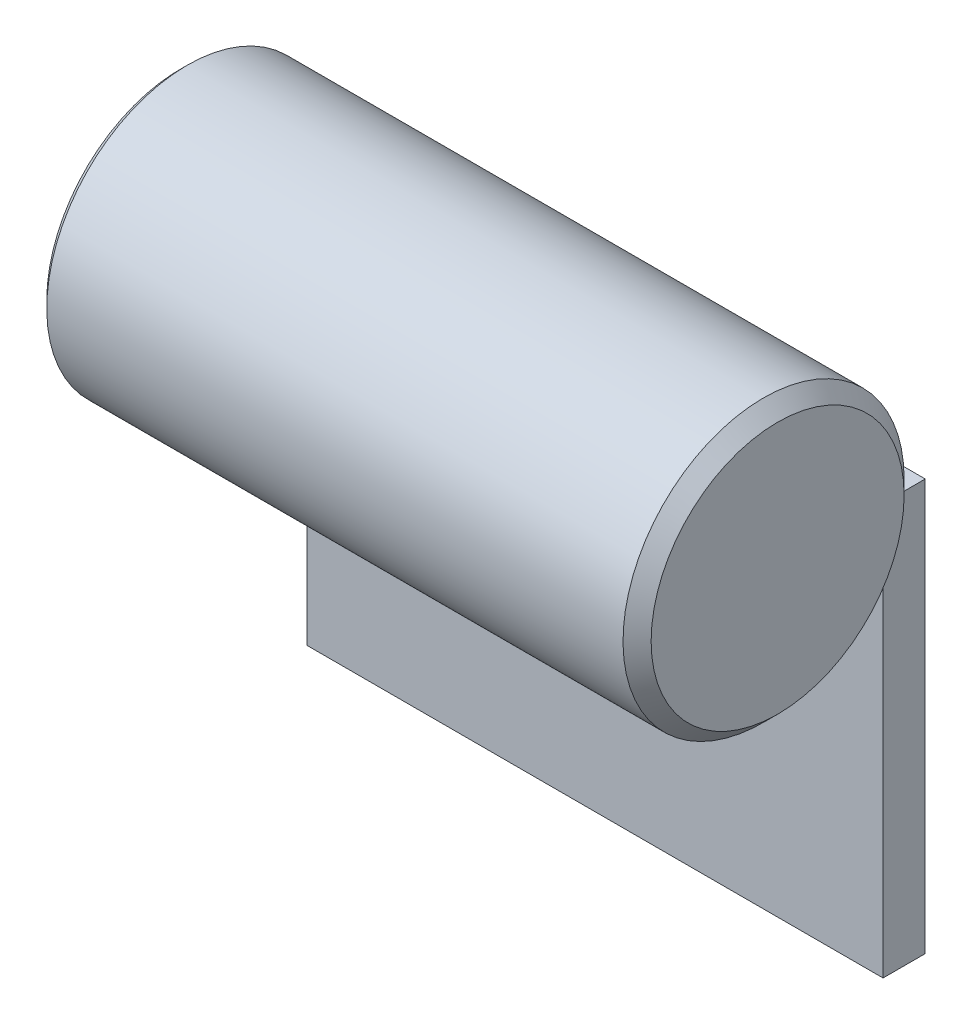
from build123d import *

# Parameters (mm, degrees)
SKETCH_2_W          = 82
SKETCH_2_H          = 6.001237201
EXTRUDE_1_DEPTH     = 60
SKETCH_3_W          = 82
SKETCH_3_H          = 3.004928021
CUT_EXTRUDE_1_DEPTH = 1.5


with BuildPart() as part:
    # Эскиз1 → Повернуть4 (revolve)
    with BuildSketch(Plane(origin=(0, 0, 0), x_dir=(1, 0, 0), z_dir=(0, 1, 0))):
        Polygon((92.65287472, 0), (92.65287472, 18), (90.65287472, 20), (8.65287472, 20), (7.65287472, 19), (7.65287472, 14.750046626), (8.65287472, 13.750046626), (71.629429714, 13.750046626), (71.629429714, 3.430205497), (76.798526349, 0), align=None)
    revolve(axis=Axis((102.994030824, 0, 0), (-1, 0, 0)))

    # Эскиз2 → Бобышка-Вытянуть1 (add)
    with BuildSketch(Plane(origin=(0, 0, 0), x_dir=(1, 0, 0), z_dir=(0, 1, 0))):
        with Locations((49.65287472, 20.004309421)):
            Rectangle(SKETCH_2_W, SKETCH_2_H)
    extrude(amount=-EXTRUDE_1_DEPTH)

    # Эскиз3 → Вырез-Вытянуть1 (cut)
    with BuildSketch(Plane(origin=(0, 0, 0), x_dir=(1, 0, 0), z_dir=(0, 1, 0))):
        with Locations((49.65287472, 21.50246401)):
            Rectangle(SKETCH_3_W, SKETCH_3_H)
    extrude(amount=-CUT_EXTRUDE_1_DEPTH, mode=Mode.SUBTRACT)


solid = part.part
